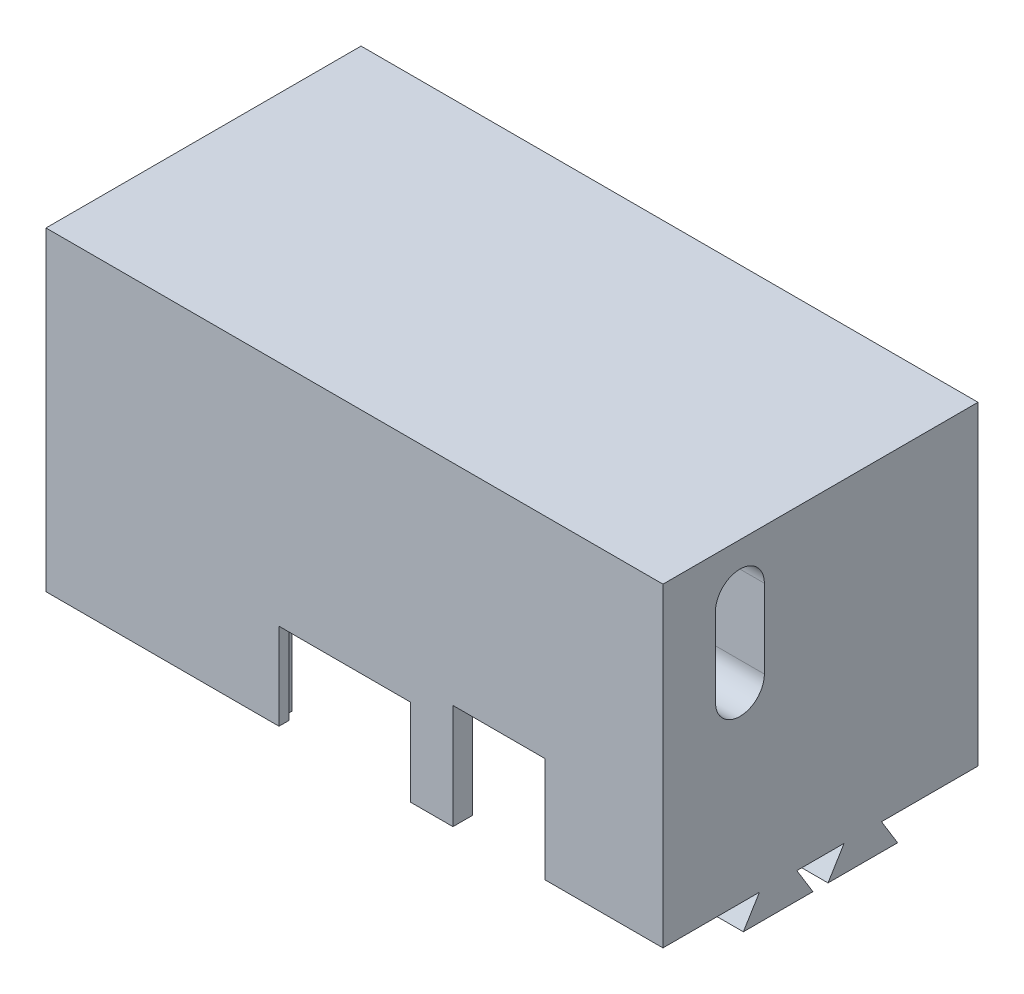
from build123d import *

# Parameters (mm, degrees)
SKETCH1_W            = 94
SKETCH1_H            = 48
BOSS_EXTRUDE1_DEPTH  = 4
SKETCH8_W            = 94
SKETCH8_H            = 48
BOSS_EXTRUDE2_DEPTH  = 21
CUT_EXTRUDE1_DEPTH   = 16
SKETCH10_W           = 94
SKETCH10_H           = 48
BOSS_EXTRUDE3_DEPTH  = 5
SKETCH15_W           = 70
SKETCH15_H           = 1.5
SKETCH15_H_2         = 3
BOSS_EXTRUDE6_DEPTH  = 4
SKETCH16_W           = 94
SKETCH16_H           = 48
SKETCH16_W_2         = 84
SKETCH16_H_2         = 43
BOSS_EXTRUDE7_DEPTH  = 18
CUT_EXTRUDE4_DEPTH   = 8
SKETCH18_W           = 2
SKETCH18_H           = 20
BOSS_EXTRUDE8_DEPTH  = 6
BOSS_EXTRUDE9_DEPTH  = 4
BOSS_EXTRUDE10_DEPTH = 4
SKETCH22_W           = 14
SKETCH22_H           = 16
CUT_EXTRUDE6_DEPTH   = 3
CUT_EXTRUDE8_DEPTH   = 13.2


with BuildPart() as part:
    # Sketch1 → Boss-Extrude1 (new body)
    with BuildSketch(Plane(origin=(0, 0, 0), x_dir=(1, 0, 0), z_dir=(0, 1, 0))):
        Rectangle(SKETCH1_W, SKETCH1_H)
    extrude(amount=BOSS_EXTRUDE1_DEPTH)

    # Sketch8 → Boss-Extrude2 (add)
    with BuildSketch(Plane(origin=(0, 0, 0), x_dir=(-1, 0, 0), z_dir=(0, -1, 0))):
        Rectangle(SKETCH8_W, SKETCH8_H)
        Polygon((34, -16), (-31, -16), (-31, 6), (-39, 6), (-39, 19), (-31, 19), (-31, 16), (34, 16), align=None, mode=Mode.SUBTRACT)
    extrude(amount=BOSS_EXTRUDE2_DEPTH)

    # Sketch9 → Cut-Extrude1 (cut)
    with BuildSketch(Plane(origin=(47, 0, 0), x_dir=(0, 0, -1), z_dir=(1, 0, 0))):
        with BuildLine():
            Line((-8.547025015, -3.603370842), (-8.547025015, -15.588001804))
            ThreePointArc((-8.547025015, -15.588001804), (-12.273512507, -19.314489297), (-16, -15.588001804))
            Line((-16, -15.588001804), (-16, -3.603370842))
            ThreePointArc((-16, -3.603370842), (-12.273512507, 0.12311665), (-8.547025015, -3.603370842))
        make_face()
    extrude(amount=-CUT_EXTRUDE1_DEPTH, mode=Mode.SUBTRACT)

    # Sketch10 → Boss-Extrude3 (add)
    with BuildSketch(Plane.XZ.offset(21)):
        Rectangle(SKETCH10_W, SKETCH10_H)
        Polygon((31, -6), (39, -6), (39, -19), (-39, -19), (-39, 21), (31, 21), align=None, mode=Mode.SUBTRACT)
    extrude(amount=BOSS_EXTRUDE3_DEPTH)

    # Sketch15 → Boss-Extrude6 (add)
    with BuildSketch(Plane.XZ.offset(21)):
        with Locations((-4, 20.25)):
            Rectangle(SKETCH15_W, SKETCH15_H)
        with Locations((-4, -17.5)):
            Rectangle(SKETCH15_W, SKETCH15_H_2)
    extrude(amount=BOSS_EXTRUDE6_DEPTH)

    # Sketch16 → Boss-Extrude7 (add)
    with BuildSketch(Plane.XZ.offset(26)):
        Rectangle(SKETCH16_W, SKETCH16_H)
        with Locations((1, -0.5)):
            Rectangle(SKETCH16_W_2, SKETCH16_H_2, mode=Mode.SUBTRACT)
    extrude(amount=BOSS_EXTRUDE7_DEPTH)

    # Sketch17 → Cut-Extrude4 (cut)
    with BuildSketch(Plane.ZY.offset(47)):
        with BuildLine():
            Line((13.36, -37.297738986), (13.36, -25.248584525))
            ThreePointArc((13.36, -25.248584525), (15, -23.608584525), (16.64, -25.248584525))
            Line((16.64, -25.248584525), (16.64, -37.297738986))
            ThreePointArc((16.64, -37.297738986), (15, -38.937738986), (13.36, -37.297738986))
        make_face()
        with BuildLine():
            Line((10.64, -37.297738986), (10.64, -25.248584525))
            ThreePointArc((10.64, -25.248584525), (9, -23.608584525), (7.36, -25.248584525))
            Line((7.36, -25.248584525), (7.36, -37.297738986))
            ThreePointArc((7.36, -37.297738986), (9, -38.937738986), (10.64, -37.297738986))
        make_face()
        with BuildLine():
            Line((4.64, -37.297738986), (4.64, -25.248584525))
            ThreePointArc((4.64, -25.248584525), (3, -23.608584525), (1.36, -25.248584525))
            Line((1.36, -25.248584525), (1.36, -37.297738986))
            ThreePointArc((1.36, -37.297738986), (3, -38.937738986), (4.64, -37.297738986))
        make_face()
        with BuildLine():
            Line((-1.36, -37.297738986), (-1.36, -25.248584525))
            ThreePointArc((-1.36, -25.248584525), (-3, -23.608584525), (-4.64, -25.248584525))
            Line((-4.64, -25.248584525), (-4.64, -37.297738986))
            ThreePointArc((-4.64, -37.297738986), (-3, -38.937738986), (-1.36, -37.297738986))
        make_face()
        with BuildLine():
            Line((-7.36, -37.297738986), (-7.36, -25.248584525))
            ThreePointArc((-7.36, -25.248584525), (-9, -23.608584525), (-10.64, -25.248584525))
            Line((-10.64, -25.248584525), (-10.64, -37.297738986))
            ThreePointArc((-10.64, -37.297738986), (-9, -38.937738986), (-7.36, -37.297738986))
        make_face()
        with BuildLine():
            Line((-13.36, -37.297738986), (-13.36, -25.248584525))
            ThreePointArc((-13.36, -25.248584525), (-15, -23.608584525), (-16.64, -25.248584525))
            Line((-16.64, -25.248584525), (-16.64, -37.297738986))
            ThreePointArc((-16.64, -37.297738986), (-15, -38.937738986), (-13.36, -37.297738986))
        make_face()
    extrude(amount=-CUT_EXTRUDE4_DEPTH, mode=Mode.SUBTRACT)

    # Sketch18 → Boss-Extrude8 (add)
    with BuildSketch(Plane.XZ.offset(44)):
        with Locations((-46, 0)):
            Rectangle(SKETCH18_W, SKETCH18_H)
    extrude(amount=BOSS_EXTRUDE8_DEPTH)

    # Sketch19 → Boss-Extrude9 (add)
    with BuildSketch(Plane(origin=(-45, 0, 0), x_dir=(0, 0, -1), z_dir=(1, 0, 0))):
        Polygon((-5.55, -44), (5.55, -44), (7.8, -48), (-7.8, -48), align=None)
    extrude(amount=BOSS_EXTRUDE9_DEPTH)

    # Sketch20 → Boss-Extrude10 (add)
    with BuildSketch(Plane(origin=(47, 0, 0), x_dir=(0, 0, -1), z_dir=(1, 0, 0))):
        Polygon((3.6, -44), (9.3, -44), (11.75, -48), (1.15, -48), align=None)
        Polygon((-3.6, -44), (-1.15, -48), (-11.75, -48), (-9.3, -44), align=None)
    extrude(amount=-BOSS_EXTRUDE10_DEPTH)

    # Sketch22 → Cut-Extrude6 (cut)
    with BuildSketch(Plane.XY.offset(24)):
        with Locations((22, -36)):
            Rectangle(SKETCH22_W, SKETCH22_H)
    extrude(amount=-CUT_EXTRUDE6_DEPTH, mode=Mode.SUBTRACT)

    # Sketch28 → Cut-Extrude8 (cut)
    with BuildSketch(Plane(origin=(0, -44, 0), x_dir=(-1, 0, 0), z_dir=(0, -1, 0))):
        Polygon((-8.5, -24), (-8.5, -22.5), (-9.5, -22.5), (-9.5, -21), (12.5, -21), (12.5, -22.5), (11.5, -22.5), (11.5, -24), align=None)
    extrude(amount=-CUT_EXTRUDE8_DEPTH, mode=Mode.SUBTRACT)


solid = part.part
